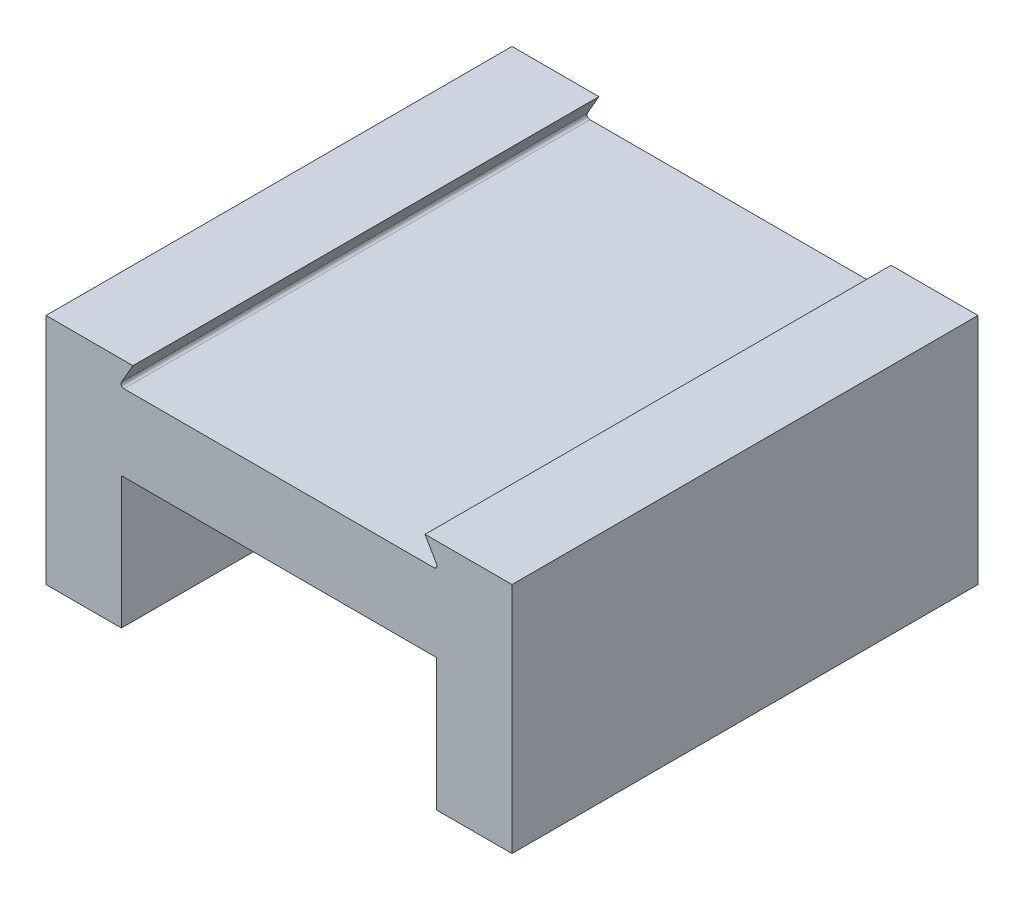
from build123d import *

# Parameters (mm, degrees)
BOSS_EXTRUDE1_DEPTH = 60
SKETCH2_R           = 4.25
CUT_EXTRUDE1_DEPTH  = 9.704955679


with BuildPart() as part:
    # Sketch1 → Boss-Extrude1 (new body)
    with BuildSketch(Plane.XY):
        with BuildLine():
            Line((-23.304685018, 17.700444455), (-23.304685018, -12.299555545))
            Line((-23.304685018, -12.299555545), (-13.599729339, -12.299555545))
            Line((-13.599729339, -12.299555545), (-13.599729339, 4.700444455))
            Line((-13.599729339, 4.700444455), (26.990359303, 4.700444455))
            Line((26.990359303, 4.700444455), (26.990359303, -12.299555545))
            Line((26.990359303, -12.299555545), (36.695314982, -12.299555545))
            Line((36.695314982, -12.299555545), (36.695314982, 17.700444455))
            Line((36.695314982, 17.700444455), (25.501661634, 17.700444455))
            Line((25.501661634, 17.700444455), (26.990359303, 15.121944455))
            ThreePointArc((26.990359303, 15.121944455), (26.990359303, 14.740944455), (26.660403624, 14.550444455))
            Line((26.660403624, 14.550444455), (-13.26977366, 14.550444455))
            ThreePointArc((-13.26977366, 14.550444455), (-13.599729339, 14.740944455), (-13.599729339, 15.121944455))
            Line((-13.599729339, 15.121944455), (-12.11103167, 17.700444455))
            Line((-12.11103167, 17.700444455), (-23.304685018, 17.700444455))
        make_face()
    extrude(amount=BOSS_EXTRUDE1_DEPTH)

    # Sketch2 → Cut-Extrude1 (cut)
    with BuildSketch(Plane.ZY.offset(23.304685018)):
        with Locations(Location((15, -2.299555545, 0), (0, 0, 270))):
            Circle(SKETCH2_R)
        with Locations(Location((45, -2.299555545, 0), (0, 0, 270))):
            Circle(SKETCH2_R)
    extrude(amount=-CUT_EXTRUDE1_DEPTH, mode=Mode.SUBTRACT)


solid = part.part
